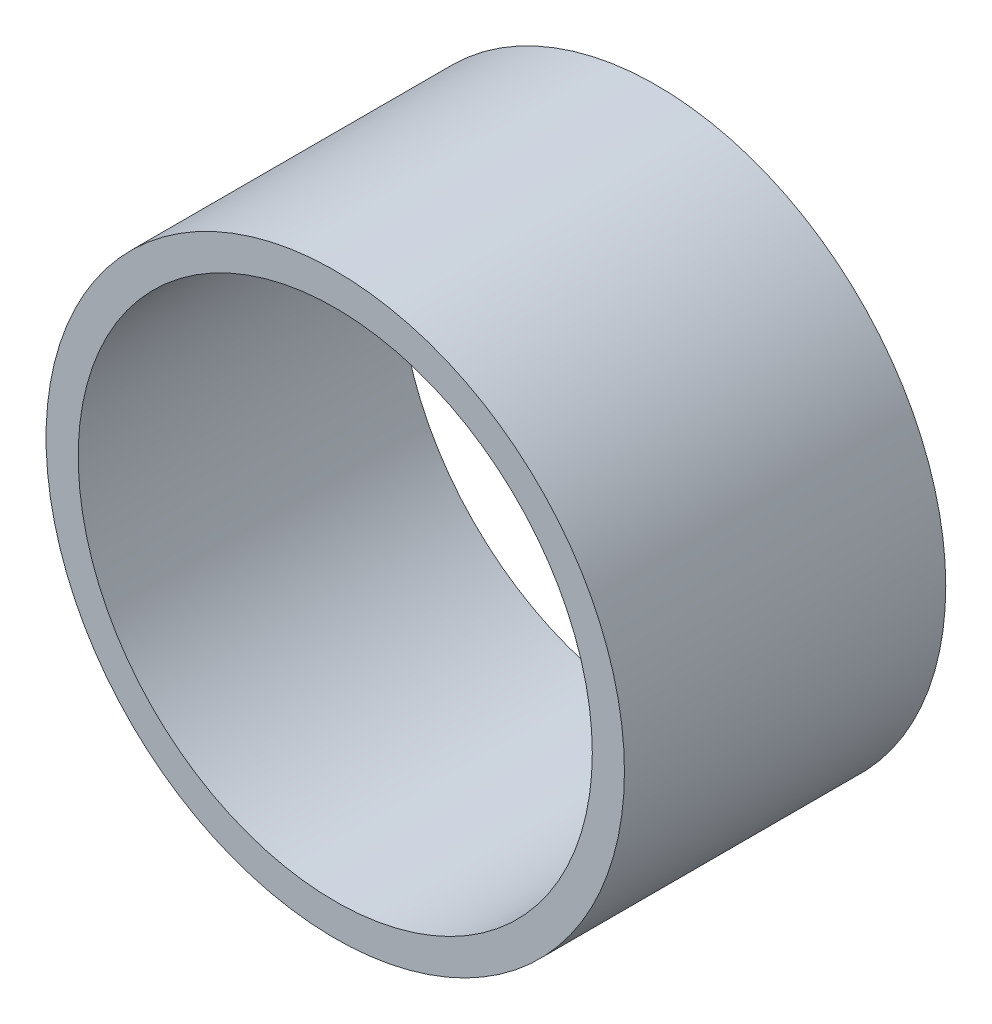
from build123d import *

# Parameters (mm, degrees)
IZIM1_R                     = 4.5
IZIM1_R_2                   = 4
Y_KSEKLIK_EKSTR_ZYON2_DEPTH = 5


with BuildPart() as part:
    # Çizim1 → Yükseklik-Ekstrüzyon2 (new body)
    with BuildSketch(Plane.XY):
        Circle(IZIM1_R)
        Circle(IZIM1_R_2, mode=Mode.SUBTRACT)
    extrude(amount=Y_KSEKLIK_EKSTR_ZYON2_DEPTH)


solid = part.part
